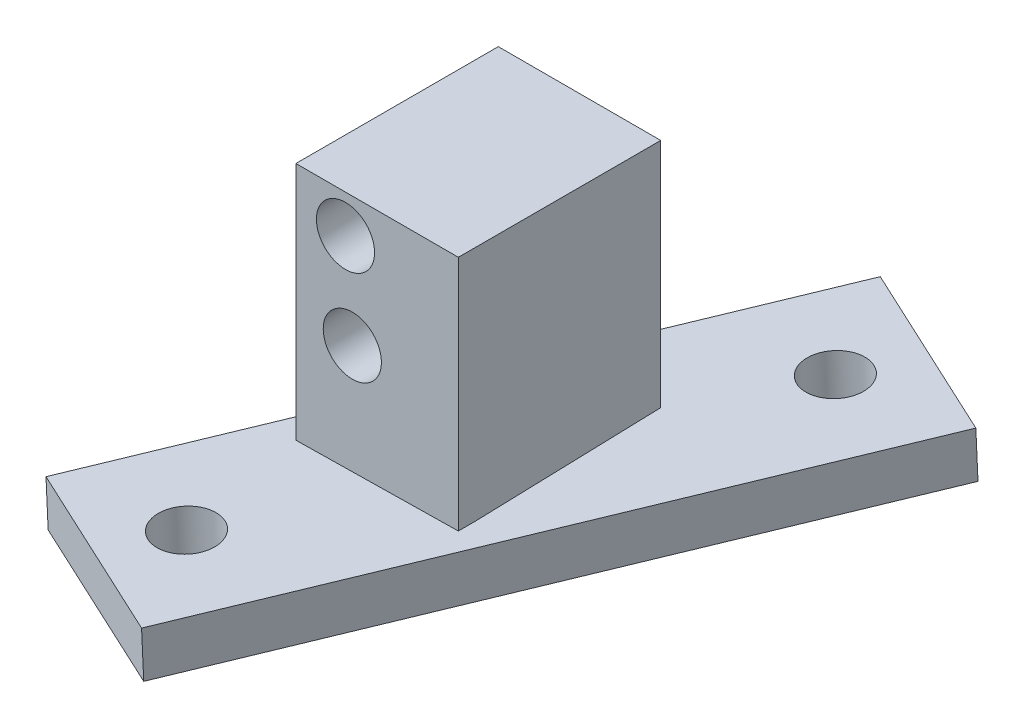
from build123d import *

# Parameters (mm, degrees)
SKETCH1_W           = 17.738061562
SKETCH1_H           = 25.606233094
SKETCH1_R           = 3.175
BOSS_EXTRUDE1_DEPTH = 22.098
SKETCH2_R           = 3.175
BOSS_EXTRUDE2_DEPTH = 5.08
BOSS_EXTRUDE3_REACH = 317.84


with BuildPart() as part:
    # Sketch1 → Boss-Extrude1 (new body)
    with BuildSketch(Plane.XY):
        with Locations((-182.918624156, 225.016931251)):
            Rectangle(SKETCH1_W, SKETCH1_H)
        with Locations(Location((-185.628460018, 223.67720197, 0), (0, 0, 180))):
            Circle(SKETCH1_R, mode=Mode.SUBTRACT)
        with Locations(Location((-186.37244208, 233.67720197, 0), (0, 0, 180))):
            Circle(SKETCH1_R, mode=Mode.SUBTRACT)
    extrude(amount=BOSS_EXTRUDE1_DEPTH)

    # Sketch2 → Boss-Extrude2 (add)
    with BuildSketch(Plane(origin=(-3.393321114, 215.043841855, 6.540236681), x_dir=(0.9998756392437432, 0.015763128213975224, 0.00047941195833239283), z_dir=(-0.01577041682759253, 0.9994135267149823, 0.030395666997209747))):
        Polygon((-199.337975212, -32.034415653), (-170.354814822, 30.120172382), (-150.787629699, 20.995844111), (-179.77079009, -41.158743924), align=None)
        with Locations(Location((-186.334031496, -29.690514452, 0), (0, 0, 270))):
            Circle(SKETCH2_R, mode=Mode.SUBTRACT)
        with Locations(Location((-163.791573415, 18.651942909, 0), (0, 0, 270))):
            Circle(SKETCH2_R, mode=Mode.SUBTRACT)
    extrude(amount=-BOSS_EXTRUDE2_DEPTH)

    # Boss-Extrude3: up to this face of the body (flat: up to its plane)
    boss_extrude3_end = Plane(part.part.faces().sort_by_distance((-182.444308909, 224.507634503, 0))[0])
    # Sketch3 → Boss-Extrude3 (add, up to the picked face)
    with BuildSketch(Plane.XY.offset(22.098), mode=Mode.PRIVATE) as boss_extrude3_sk1:
        Polygon((-191.787654937, 212.213814704), (-191.787654937, 211.652316966), (-174.049593375, 211.933065835), (-174.049593375, 212.213814704), align=None)
    boss_extrude3_tool1 = split(extrude(boss_extrude3_sk1.sketch, amount=-BOSS_EXTRUDE3_REACH, mode=Mode.PRIVATE), bisect_by=boss_extrude3_end, keep=Keep.BOTH, mode=Mode.PRIVATE)
    add(boss_extrude3_tool1.solids().sort_by(Axis((-183.904072, 211.995454, 22.098), (0, 0, -1)))[0])


solid = part.part
